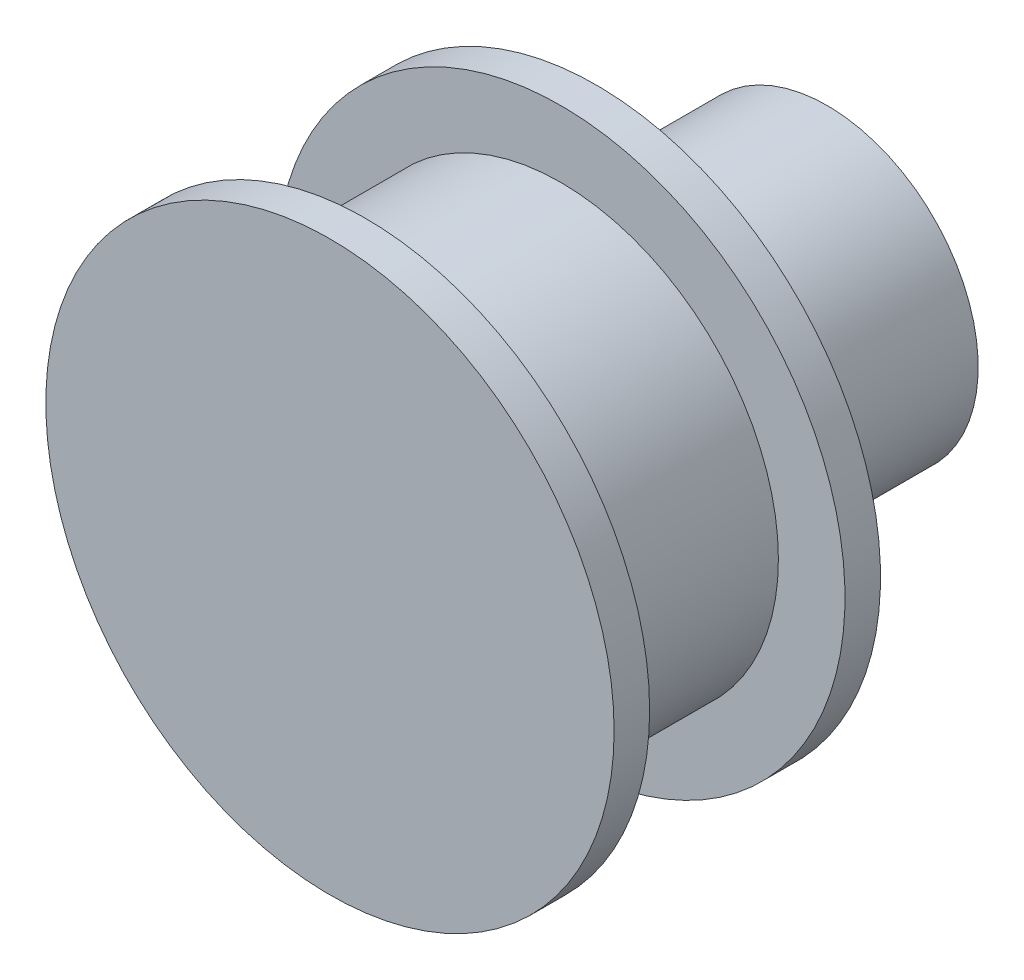
from build123d import *

# Parameters (mm, degrees)
SKETCH1_R           = 12.25
BOSS_EXTRUDE1_DEPTH = 11
SKETCH2_R           = 16
BOSS_EXTRUDE2_DEPTH = 2
SKETCH4_R           = 10
BOSS_EXTRUDE4_DEPTH = 1
SKETCH5_R           = 8.5
BOSS_EXTRUDE5_DEPTH = 12
SKETCH6_R           = 6
CUT_EXTRUDE1_DEPTH  = 35.467375879
CHAMFER1_SIZE       = 1
BOSS_EXTRUDE6_START = 2
SKETCH3_R           = 16
BOSS_EXTRUDE6_DEPTH = 2


with BuildPart() as part:
    # Sketch1 → Boss-Extrude1 (new body)
    with BuildSketch(Plane.XY):
        Circle(SKETCH1_R)
    extrude(amount=BOSS_EXTRUDE1_DEPTH)

    # Sketch2 → Boss-Extrude2 (add)
    with BuildSketch(Plane(origin=(0, 0, 0), x_dir=(-1, 0, 0), z_dir=(0, 0, -1))):
        Circle(SKETCH2_R)
    extrude(amount=BOSS_EXTRUDE2_DEPTH)

    # Sketch4 → Boss-Extrude4 (add)
    with BuildSketch(Plane(origin=(0, 0, -2), x_dir=(-1, 0, 0), z_dir=(0, 0, -1))):
        Circle(SKETCH4_R)
    extrude(amount=BOSS_EXTRUDE4_DEPTH)

    # Sketch5 → Boss-Extrude5 (add)
    with BuildSketch(Plane(origin=(0, 0, -3), x_dir=(-1, 0, 0), z_dir=(0, 0, -1))):
        Circle(SKETCH5_R)
    extrude(amount=BOSS_EXTRUDE5_DEPTH)

    # Sketch6 → Cut-Extrude1 (cut, through all)
    with BuildSketch(Plane(origin=(0, 0, -15), x_dir=(-1, 0, 0), z_dir=(0, 0, -1))):
        Circle(SKETCH6_R)
    extrude(amount=-CUT_EXTRUDE1_DEPTH, mode=Mode.SUBTRACT)

    # Chamfer1
    chamfer1_edges = [part.edges().sort_by_distance(p)[0] for p in [
        (6, 0, -15),
    ]]
    chamfer(chamfer1_edges, length=CHAMFER1_SIZE)

    # Sketch3 → Boss-Extrude6 (add)
    with BuildSketch(Plane.XY.offset(11).offset(BOSS_EXTRUDE6_START)):
        with Locations(Location((0, 0, 0), (0, 0, 180))):
            Circle(SKETCH3_R)
    extrude(amount=-BOSS_EXTRUDE6_DEPTH)


solid = part.part
